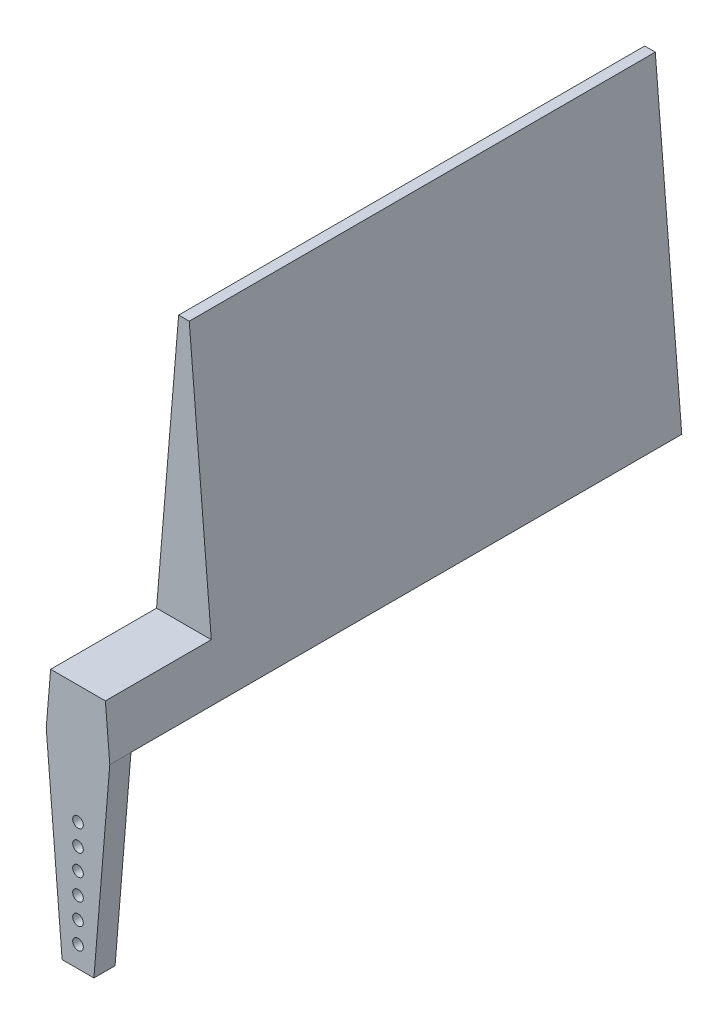
from build123d import *

# Parameters (mm, degrees)
BOSS_EXTRUDE1_DEPTH = 44
BOSS_EXTRUDE3_DEPTH = 10
SKETCH4_R           = 0.5
BOSS_EXTRUDE4_DEPTH = 2


with BuildPart() as part:
    # Sketch1 → Boss-Extrude1 (new body)
    with BuildSketch(Plane.XY):
        Polygon((63.072235962, 50.72786335), (64.072235962, 50.72786335), (66.572235962, 20.72786335), (60.572235962, 20.72786335), align=None)
    extrude(amount=-BOSS_EXTRUDE1_DEPTH)

    # Sketch3 → Boss-Extrude3 (add)
    with BuildSketch(Plane.XY):
        Polygon((60.572235962, 20.72786335), (60.988902629, 25.72786335), (66.155569295, 25.72786335), (66.572235962, 20.72786335), align=None)
    extrude(amount=BOSS_EXTRUDE3_DEPTH)

    # Sketch4 → Boss-Extrude4 (add)
    with BuildSketch(Plane.XY.offset(10)):
        Polygon((66.572235962, 20.72786335), (60.572235962, 20.72786335), (62.072235962, 2.52786335), (65.072235962, 2.52786335), align=None)
        with Locations(Location((63.572235962, 14.52786335, 0), (0, 0, 180))):
            Circle(SKETCH4_R, mode=Mode.SUBTRACT)
        with Locations(Location((63.572235962, 12.52786335, 0), (0, 0, 180))):
            Circle(SKETCH4_R, mode=Mode.SUBTRACT)
        with Locations(Location((63.572235962, 10.52786335, 0), (0, 0, 180))):
            Circle(SKETCH4_R, mode=Mode.SUBTRACT)
        with Locations(Location((63.572235962, 8.52786335, 0), (0, 0, 180))):
            Circle(SKETCH4_R, mode=Mode.SUBTRACT)
        with Locations(Location((63.572235962, 4.52786335, 0), (0, 0, 180))):
            Circle(SKETCH4_R, mode=Mode.SUBTRACT)
        with Locations(Location((63.572235962, 6.52786335, 0), (0, 0, 180))):
            Circle(SKETCH4_R, mode=Mode.SUBTRACT)
    extrude(amount=-BOSS_EXTRUDE4_DEPTH)


solid = part.part
